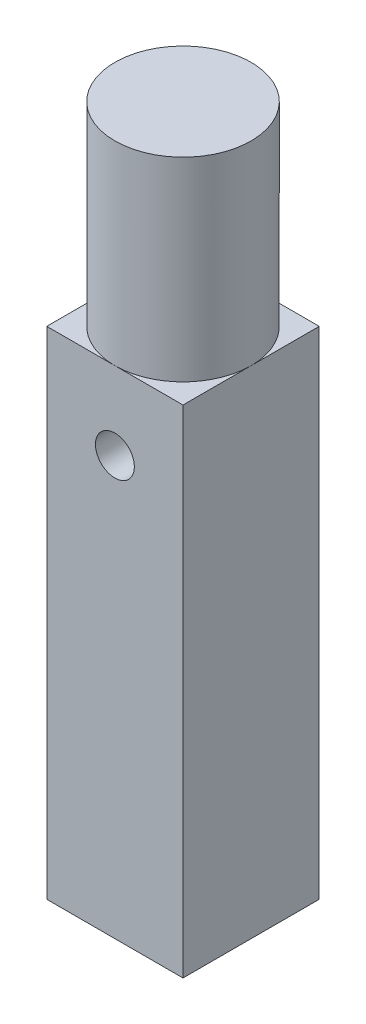
from build123d import *

# Parameters (mm, degrees)
SKETCH1_W               = 88.9
SKETCH1_H               = 88.9
BOSS_EXTRUDE1_DEPTH     = 450.85
CUT_EXTRUDE1_DEPTH      = 127
CUT_EXTRUDE2_DEPTH      = 456.211299838
CUT_EXTRUDE2_DEPTH_BACK = 456.211299838
SKETCH3_R               = 12.7


with BuildPart() as part:
    # Sketch1 → Boss-Extrude1 (new body)
    with BuildSketch(Plane(origin=(0, 0, 0), x_dir=(1, 0, 0), z_dir=(0, 1, 0))):
        Rectangle(SKETCH1_W, SKETCH1_H)
    extrude(amount=BOSS_EXTRUDE1_DEPTH)

    # Sketch2 → Cut-Extrude1 (cut)
    with BuildSketch(Plane(origin=(0, 450.85, 0), x_dir=(1, 0, 0), z_dir=(0, 1, 0))):
        with BuildLine():
            Line((-44.45, -44.45), (-1.97e-07, -44.45))
            ThreePointArc((-1.97e-07, -44.45), (-31.430896472, -31.430896376), (-44.45, -6.1e-08))
            Line((-44.45, -6.1e-08), (-44.45, -44.45))
        make_face()
        with BuildLine():
            ThreePointArc((-44.45, -6.1e-08), (-31.430896452, 31.430896396), (-1.8e-08, 44.45))
            Line((-1.8e-08, 44.45), (-44.45, 44.45))
            Line((-44.45, 44.45), (-44.45, -6.1e-08))
        make_face()
        with BuildLine():
            ThreePointArc((-1.8e-08, 44.45), (31.430896417, 31.43089643), (44.45, 0))
            Line((44.45, 0), (44.45, 44.45))
            Line((44.45, 44.45), (-1.8e-08, 44.45))
        make_face()
        with BuildLine():
            Line((44.45, -44.45), (44.45, 0))
            ThreePointArc((44.45, 0), (31.430896354, -31.430896493), (-1.97e-07, -44.45))
            Line((-1.97e-07, -44.45), (44.45, -44.45))
        make_face()
    extrude(amount=-CUT_EXTRUDE1_DEPTH, mode=Mode.SUBTRACT)

    # Sketch3 → Cut-Extrude2 (cut, two sides: drawn at the far end of the back side and taken through both)
    with BuildSketch(Plane.XY.offset(-CUT_EXTRUDE2_DEPTH_BACK)):
        with Locations((0, 273.05)):
            Circle(SKETCH3_R)
    extrude(amount=CUT_EXTRUDE2_DEPTH + CUT_EXTRUDE2_DEPTH_BACK, mode=Mode.SUBTRACT)


solid = part.part
